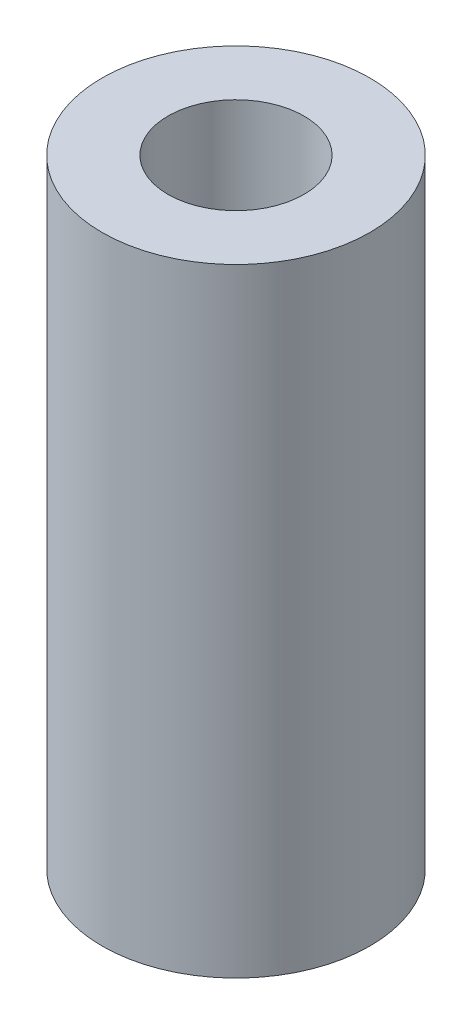
from build123d import *

# Parameters (mm, degrees)
SKETCH1_R           = 3.25
SKETCH1_R_2         = 1.65
BOSS_EXTRUDE1_DEPTH = 15


with BuildPart() as part:
    # Sketch1 → Boss-Extrude1 (new body)
    with BuildSketch(Plane(origin=(0, 0, 0), x_dir=(1, 0, 0), z_dir=(0, 1, 0))):
        with Locations(Location((0, 0, 0), (0, 0, 270))):
            Circle(SKETCH1_R)
        with Locations(Location((0, 0, 0), (0, 0, 270))):
            Circle(SKETCH1_R_2, mode=Mode.SUBTRACT)
    extrude(amount=BOSS_EXTRUDE1_DEPTH)


solid = part.part
